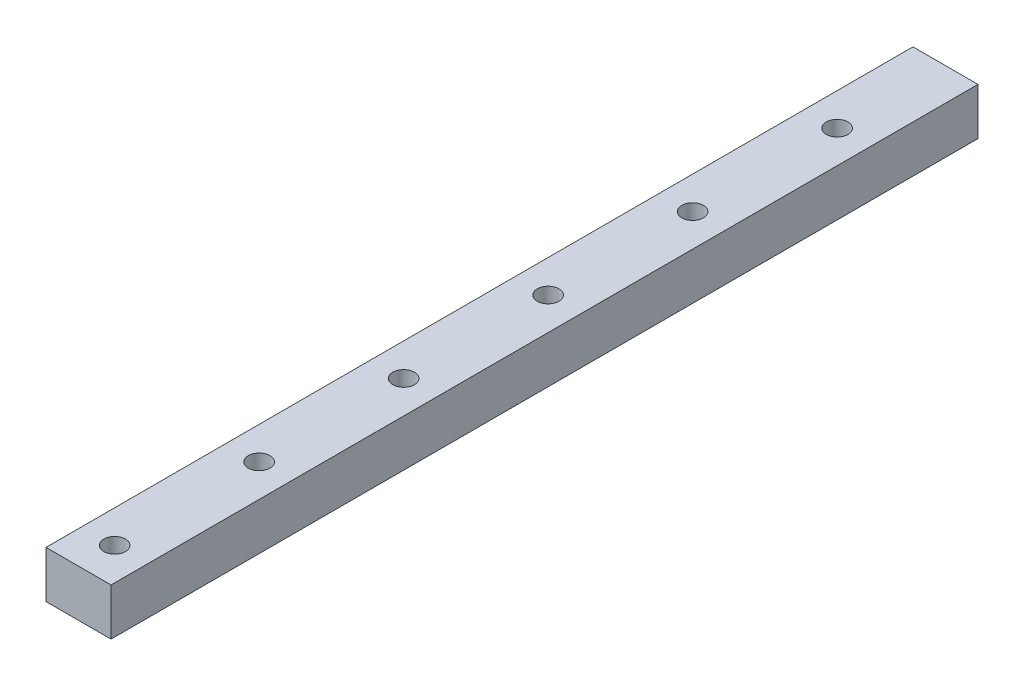
from build123d import *

# Parameters (mm, degrees)
SKETCH_1_W          = 9
SKETCH_1_H          = 6.5
EXTRUDE_1_DEPTH     = 120
SKETCH_2_R          = 1.5
CUT_EXTRUDE_1_DEPTH = 100


with BuildPart() as part:
    # 草图1 → 凸台-拉伸1 (new body)
    with BuildSketch(Plane.XY):
        with Locations((4.5, 3.25)):
            Rectangle(SKETCH_1_W, SKETCH_1_H)
    extrude(amount=EXTRUDE_1_DEPTH)

    # 草图2 → 切除-拉伸1 (cut)
    with BuildSketch(Plane(origin=(0, 6.5, 0), x_dir=(1, 0, 0), z_dir=(0, 1, 0))):
        with Locations(Location((4.5, -115, 0), (0, 0, 270))):
            Circle(SKETCH_2_R)
        with Locations(Location((4.5, -95, 0), (0, 0, 270))):
            Circle(SKETCH_2_R)
        with Locations(Location((4.5, -75, 0), (0, 0, 270))):
            Circle(SKETCH_2_R)
        with Locations(Location((4.5, -55, 0), (0, 0, 270))):
            Circle(SKETCH_2_R)
        with Locations(Location((4.5, -35, 0), (0, 0, 270))):
            Circle(SKETCH_2_R)
        with Locations(Location((4.5, -15, 0), (0, 0, 270))):
            Circle(SKETCH_2_R)
    extrude(amount=-CUT_EXTRUDE_1_DEPTH, mode=Mode.SUBTRACT)


solid = part.part
